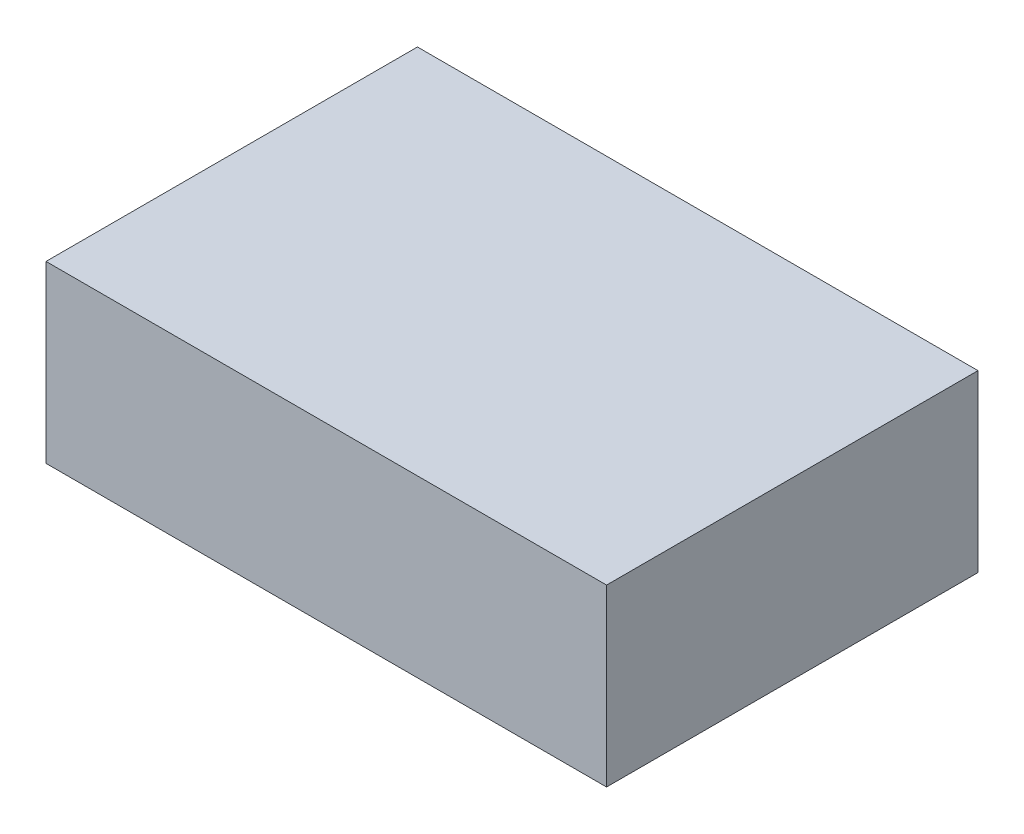
from build123d import *

# Parameters (mm, degrees)
SKETCH1_W           = 320.484325968
SKETCH1_H           = 212.355742264
BOSS_EXTRUDE1_DEPTH = 100


with BuildPart() as part:
    # Sketch1 → Boss-Extrude1 (new body)
    with BuildSketch(Plane(origin=(0, 38.1, 0), x_dir=(1, 0, 0), z_dir=(0, 1, 0))):
        with Locations((0, -1050)):
            Rectangle(SKETCH1_W, SKETCH1_H)
    extrude(amount=BOSS_EXTRUDE1_DEPTH)


solid = part.part
